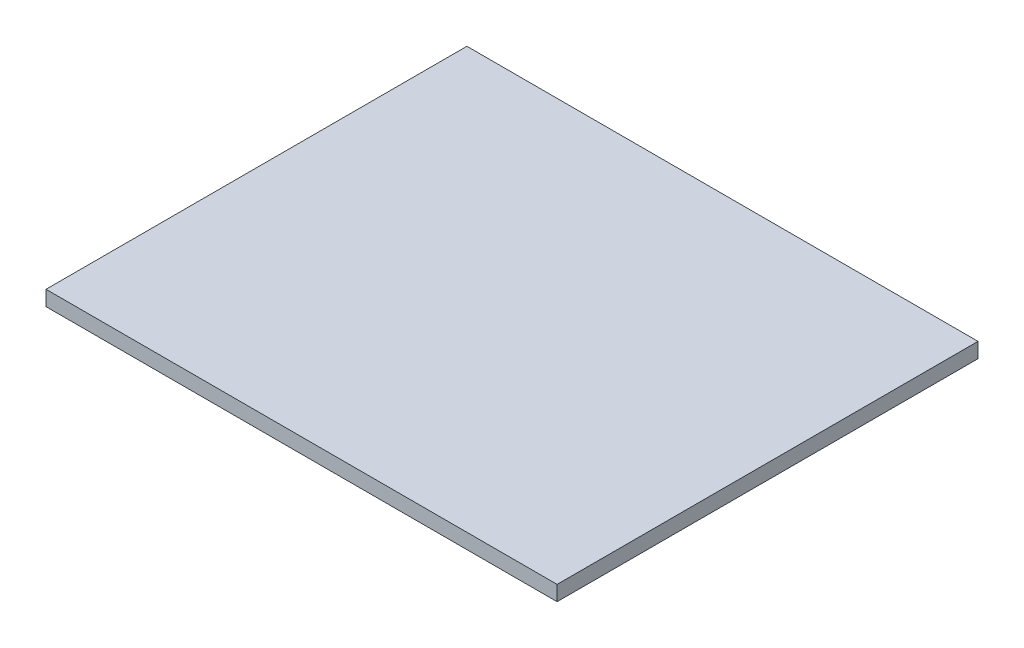
from build123d import *

# Parameters (mm, degrees)
SKETCH_1_W      = 170
SKETCH_1_H      = 140
EXTRUDE_1_DEPTH = 5


with BuildPart() as part:
    # 스케치1 → 보스-돌출1 (new body)
    with BuildSketch(Plane(origin=(0, 0, 0), x_dir=(1, 0, 0), z_dir=(0, 1, 0))):
        with Locations((85, 70)):
            Rectangle(SKETCH_1_W, SKETCH_1_H)
    extrude(amount=EXTRUDE_1_DEPTH)


solid = part.part
